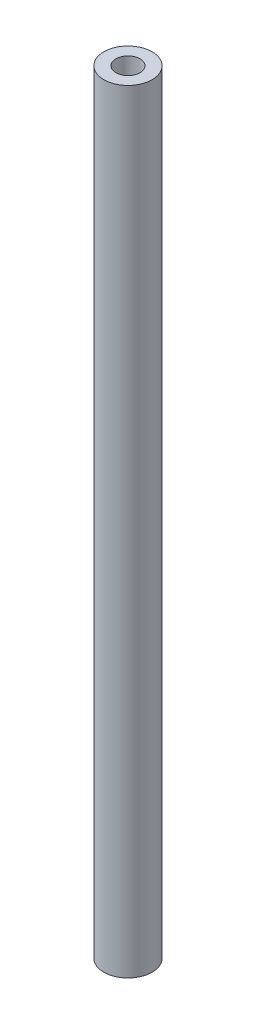
from build123d import *

# Parameters (mm, degrees)
SKETCH1_R           = 6.35
SKETCH1_R_2         = 3.175
BOSS_EXTRUDE1_DEPTH = 203.2


with BuildPart() as part:
    # Sketch1 → Boss-Extrude1 (new body)
    with BuildSketch(Plane(origin=(0, 0, 0), x_dir=(1, 0, 0), z_dir=(0, 1, 0))):
        with Locations(Location((0, 0, 0), (0, 0, 270))):
            Circle(SKETCH1_R)
        with Locations(Location((0, 0, 0), (0, 0, 270))):
            Circle(SKETCH1_R_2, mode=Mode.SUBTRACT)
    extrude(amount=BOSS_EXTRUDE1_DEPTH)


solid = part.part
